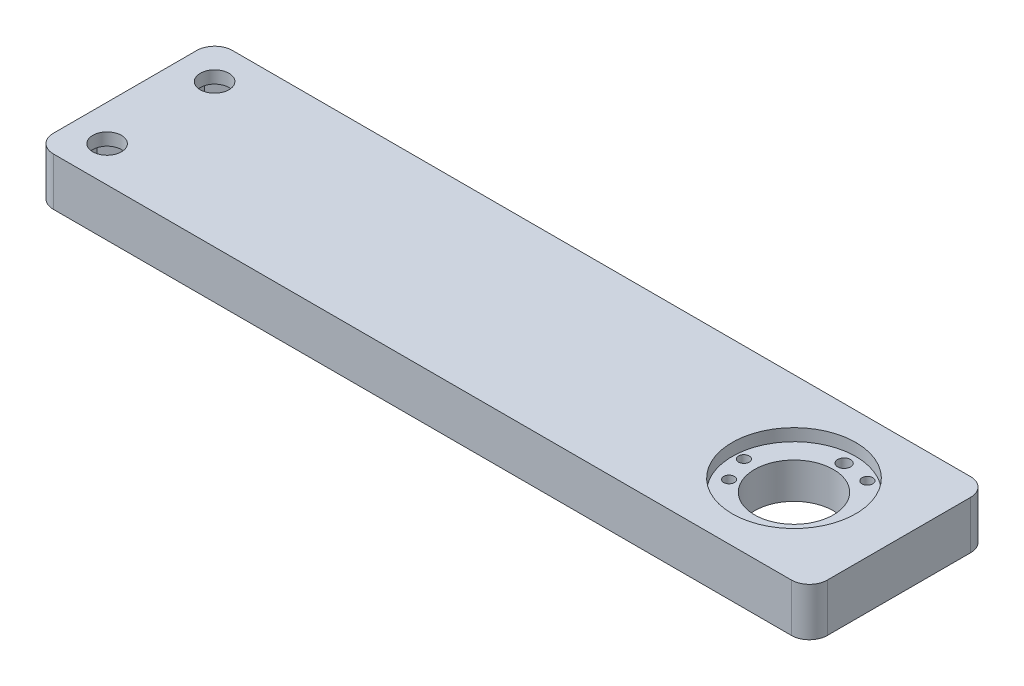
from build123d import *
from build123d.topology import SkipClean

# Parameters (mm, degrees)
SKETCH1_R               = 4
SKETCH1_R_2             = 11
SKETCH1_R_3             = 1.5
BOSS_EXTRUDE1_DEPTH     = 10
SKETCH5_R               = 17.25
CUT_EXTRUDE1_DEPTH      = 3.4
BOSS_EXTRUDE2_START     = 3.4
SKETCH6_R               = 1.8
SKETCH6_R_2             = 1.5
SKETCH6_R_3             = 11
SKETCH6_R_4             = 4
BOSS_EXTRUDE2_DEPTH     = 3.4
CUT_EXTRUDE2_DEPTH      = 3.25
CUT_EXTRUDE2_DEPTH_BACK = 3.75


with BuildPart() as part:
    # Sketch1 → Boss-Extrude1 (new body)
    with BuildSketch(Plane(origin=(0, 0, 0), x_dir=(1, 0, 0), z_dir=(0, 1, 0))):
        with BuildLine():
            Line((-103, -25), (103, -25))
            ThreePointArc((103, -25), (106.535533906, -23.535533906), (108, -20))
            Line((108, -20), (108, 20))
            ThreePointArc((108, 20), (106.535533906, 23.535533906), (103, 25))
            Line((103, 25), (-103, 25))
            ThreePointArc((-103, 25), (-106.535533906, 23.535533906), (-108, 20))
            Line((-108, 20), (-108, -20))
            ThreePointArc((-108, -20), (-106.535533906, -23.535533906), (-103, -25))
        make_face()
        with Locations(Location((-98, 15, 0), (0, 0, 270))):
            Circle(SKETCH1_R, mode=Mode.SUBTRACT)
        with Locations(Location((-98, -15, 0), (0, 0, 270))):
            Circle(SKETCH1_R, mode=Mode.SUBTRACT)
        with Locations(Location((78.7, 0, 0), (0, 0, 270))):
            Circle(SKETCH1_R_2, mode=Mode.SUBTRACT)
        with Locations(Location((78.7, 14, 0), (0, 0, 270))):
            Circle(SKETCH1_R_3, mode=Mode.SUBTRACT)
        with Locations(Location((86.2, 12.99038106, 0), (0, 0, 270))):
            Circle(SKETCH1_R_3, mode=Mode.SUBTRACT)
        with Locations(Location((90.82435565, -7.000000002, 0), (0, 0, 270))):
            Circle(SKETCH1_R_3, mode=Mode.SUBTRACT)
        with Locations(Location((86.199999997, -12.990381058, 0), (0, 0, 270))):
            Circle(SKETCH1_R_3, mode=Mode.SUBTRACT)
        with Locations(Location((63.7, 1.008931637, 0), (0, 0, 270))):
            Circle(SKETCH1_R_3, mode=Mode.SUBTRACT)
        with Locations(Location((66.57564435, -5.991068363, 0), (0, 0, 270))):
            Circle(SKETCH1_R_3, mode=Mode.SUBTRACT)
    extrude(amount=BOSS_EXTRUDE1_DEPTH)

    # Sketch4 → CBORE for M3 Hex Socket Head Cap Screw1 (revolve, cut)
    with BuildSketch(Plane(origin=(78.7, 10, -14), x_dir=(0, 0, 1), z_dir=(1, 0, 0))):
        Polygon((0, 0), (0, 10), (1.8, 10), (1.8, 3.4), (3.25, 3.4), (3.25, 0.025), (3.275, 0), align=None)
    revolve(axis=Axis((78.7, 16.35, -14), (0, -1, 0)), mode=Mode.SUBTRACT)

    # Sketch5 → Cut-Extrude1 (cut)
    with BuildSketch(Plane(origin=(0, 10, 0), x_dir=(1, 0, 0), z_dir=(0, 1, 0))):
        with Locations(Location((78.7, 0, 0), (0, 0, 91.489143503))):
            Circle(SKETCH5_R)
    extrude(amount=-CUT_EXTRUDE1_DEPTH, mode=Mode.SUBTRACT)

    # Sketch6 → Boss-Extrude2 (add)
    with SkipClean():  # the faces are left unmerged after this step: merging them gives an invalid solid
        with BuildSketch(Plane.XZ.offset(BOSS_EXTRUDE2_START)):
            with BuildLine():
                Line((-103, -25), (103, -25))
                ThreePointArc((103, -25), (106.535533906, -23.535533906), (108, -20))
                Line((108, -20), (108, 20))
                ThreePointArc((108, 20), (106.535533906, 23.535533906), (103, 25))
                Line((103, 25), (-103, 25))
                ThreePointArc((-103, 25), (-106.535533906, 23.535533906), (-108, 20))
                Line((-108, 20), (-108, -20))
                ThreePointArc((-108, -20), (-106.535533906, -23.535533906), (-103, -25))
            make_face()
            with Locations(Location((78.7, -14, 0), (0, 0, 90))):
                Circle(SKETCH6_R, mode=Mode.SUBTRACT)
            with Locations(Location((86.2, -12.99038106, 0), (0, 0, 270))):
                Circle(SKETCH6_R_2, mode=Mode.SUBTRACT)
            with Locations(Location((90.82435565, 7.000000002, 0), (0, 0, 270))):
                Circle(SKETCH6_R_2, mode=Mode.SUBTRACT)
            with Locations(Location((86.199999997, 12.990381058, 0), (0, 0, 270))):
                Circle(SKETCH6_R_2, mode=Mode.SUBTRACT)
            with Locations(Location((78.7, 0, 0), (0, 0, 270))):
                Circle(SKETCH6_R_3, mode=Mode.SUBTRACT)
            with Locations(Location((66.57564435, 5.991068363, 0), (0, 0, 270))):
                Circle(SKETCH6_R_2, mode=Mode.SUBTRACT)
            with Locations(Location((63.7, -1.008931637, 0), (0, 0, 270))):
                Circle(SKETCH6_R_2, mode=Mode.SUBTRACT)
            with Locations(Location((-98, -15, 0), (0, 0, 270))):
                Circle(SKETCH6_R_4, mode=Mode.SUBTRACT)
            with Locations(Location((-98, 15, 0), (0, 0, 270))):
                Circle(SKETCH6_R_4, mode=Mode.SUBTRACT)
        extrude(amount=-BOSS_EXTRUDE2_DEPTH)

    # Sketch7 → Cut-Extrude2 (cut, two sides: drawn at the far end of the back side and taken through both)
    with BuildSketch(Plane(origin=(0, 3.3, 0), x_dir=(1, 0, 0), z_dir=(0, 1, 0)).offset(-CUT_EXTRUDE2_DEPTH_BACK)):
        Polygon((-91.3, 11.131753196), (-91.3, 18.868246804), (-98, 22.736493607), (-104.7, 18.868246804), (-104.7, 11.131753196), (-98, 7.263506393), align=None)
        Polygon((-91.3, -18.868246804), (-91.3, -11.131753196), (-98, -7.263506393), (-104.7, -11.131753196), (-104.7, -18.868246804), (-98, -22.736493607), align=None)
    extrude(amount=CUT_EXTRUDE2_DEPTH + CUT_EXTRUDE2_DEPTH_BACK, mode=Mode.SUBTRACT)


solid = part.part
